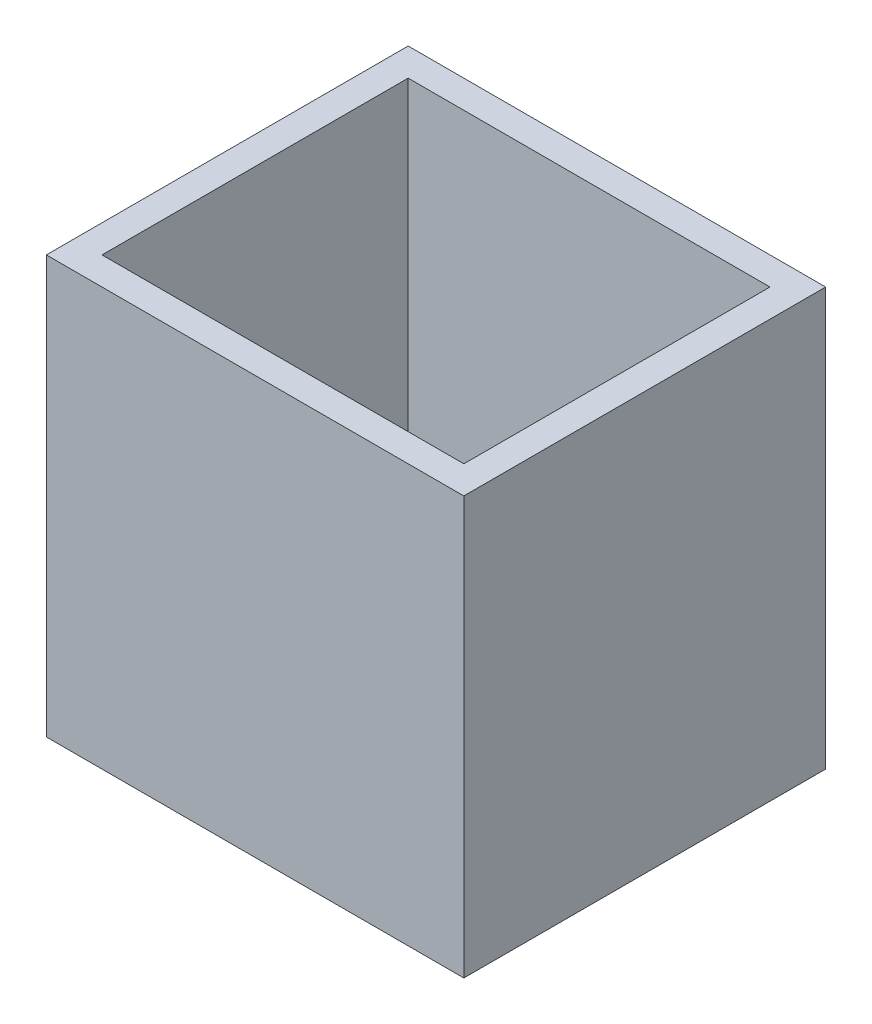
from build123d import *

# Parameters (mm, degrees)
SKETCH1_W           = 150
SKETCH1_H           = 150
BOSS_EXTRUDE2_DEPTH = 130
SKETCH3_W           = 130
SKETCH3_H           = 110
CUT_EXTRUDE2_DEPTH  = 110


with BuildPart() as part:
    # Sketch1 → Boss-Extrude2 (new body)
    with BuildSketch(Plane.XY):
        with Locations((75, 75)):
            Rectangle(SKETCH1_W, SKETCH1_H)
    extrude(amount=BOSS_EXTRUDE2_DEPTH)

    # Sketch3 → Cut-Extrude2 (cut)
    with BuildSketch(Plane(origin=(0, 150, 0), x_dir=(1, 0, 0), z_dir=(0, 1, 0))):
        with Locations((75, -65)):
            Rectangle(SKETCH3_W, SKETCH3_H)
    extrude(amount=-CUT_EXTRUDE2_DEPTH, mode=Mode.SUBTRACT)


solid = part.part
